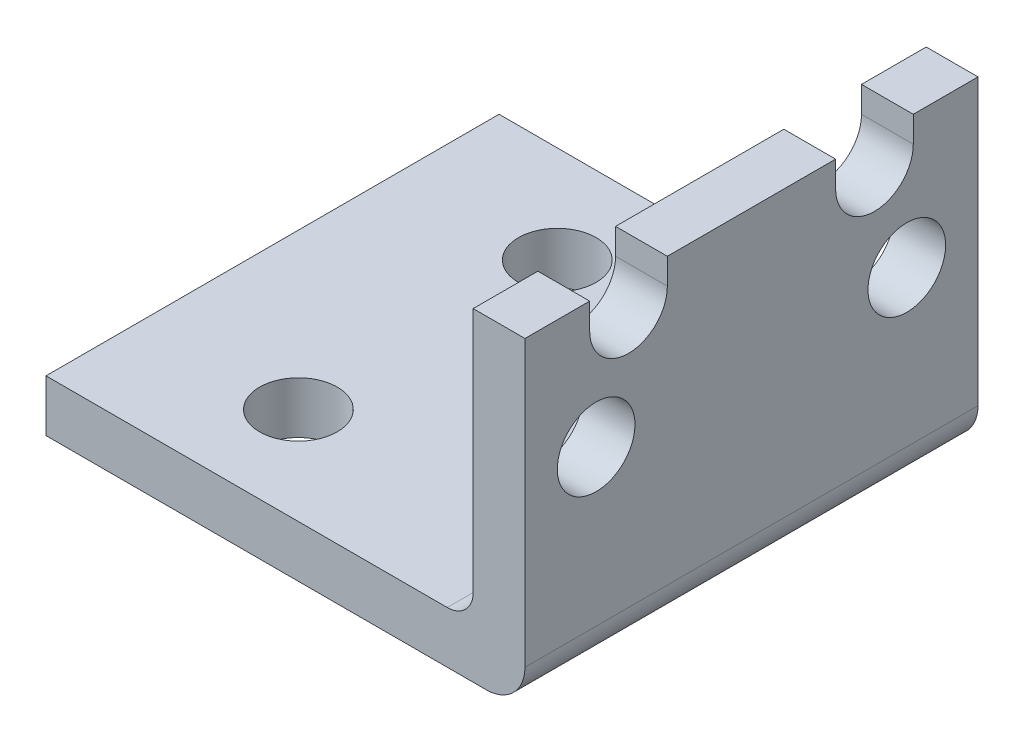
from build123d import *

# Parameters (mm, degrees)
EXTRUDE_1_DEPTH     = 35
SKETCH_2_R          = 3
CUT_EXTRUDE_2_DEPTH = 35
SKETCH_3_R          = 3
EXTRUDE_4_DEPTH     = 37
SKETCH_3_2_R        = 3
CUT_EXTRUDE_5_DEPTH = 57.771215716


with BuildPart() as part:
    # 草图1 → 拉伸1 (new body)
    with BuildSketch(Plane.XY):
        with BuildLine():
            ThreePointArc((18.167628925, -21.079292929), (19.581842488, -20.493506492), (20.167628925, -19.079292929))
            Line((20.167628925, -19.079292929), (20.167628925, -0.079292929))
            Line((20.167628925, -0.079292929), (24.167628925, -0.079292929))
            Line((24.167628925, -0.079292929), (24.167628925, -22.079292929))
            ThreePointArc((24.167628925, -22.079292929), (23.288949269, -24.200613273), (21.167628925, -25.079292929))
            Line((21.167628925, -25.079292929), (-12.832371075, -25.079292929))
            Line((-12.832371075, -25.079292929), (-12.832371075, -21.079292929))
            Line((-12.832371075, -21.079292929), (18.167628925, -21.079292929))
        make_face()
    extrude(amount=EXTRUDE_1_DEPTH)

    # 草图2 → 拉伸2 (cut)
    with BuildSketch(Plane.XZ.offset(25.079292929)):
        with Locations((-0.832371075, 7.5)):
            Circle(SKETCH_2_R)
        with Locations((-0.832371075, 27.5)):
            Circle(SKETCH_2_R)
    extrude(amount=-CUT_EXTRUDE_2_DEPTH, mode=Mode.SUBTRACT)

    # 草图3 → 拉伸4 (add, through all)
    with BuildSketch(Plane(origin=(24.167628925, 0, 0), x_dir=(0, 0, -1), z_dir=(1, 0, 0))):
        with Locations(Location((-5.5, -10.079292929, 0), (0, 0, 90))):
            Circle(SKETCH_3_R)
        with Locations(Location((-29.5, -10.079292929, 0), (0, 0, 90))):
            Circle(SKETCH_3_R)
        with BuildLine():
            Line((-5, -2.079292929), (-5, 0.455458984))
            Line((-5, 0.455458984), (-11, 0.455458984))
            Line((-11, 0.455458984), (-11, -2.079292929))
            ThreePointArc((-11, -2.079292929), (-8, -5.079292929), (-5, -2.079292929))
        make_face()
        with BuildLine():
            Line((-24, -2.079292929), (-24, 0.455458984))
            Line((-24, 0.455458984), (-30, 0.455458984))
            Line((-30, 0.455458984), (-30, -2.079292929))
            ThreePointArc((-30, -2.079292929), (-27, -5.079292929), (-24, -2.079292929))
        make_face()
    extrude(amount=-EXTRUDE_4_DEPTH)

    # 草图3<2> → 拉伸5 (cut, through all)
    with BuildSketch(Plane(origin=(24.167628925, 0, 0), x_dir=(0, 0, -1), z_dir=(1, 0, 0))):
        with Locations(Location((-5.5, -10.079292929, 0), (0, 0, 90))):
            Circle(SKETCH_3_2_R)
        with Locations(Location((-29.5, -10.079292929, 0), (0, 0, 90))):
            Circle(SKETCH_3_2_R)
        with BuildLine():
            Line((-5, -2.079292929), (-5, 0.455458984))
            Line((-5, 0.455458984), (-11, 0.455458984))
            Line((-11, 0.455458984), (-11, -2.079292929))
            ThreePointArc((-11, -2.079292929), (-8, -5.079292929), (-5, -2.079292929))
        make_face()
        with BuildLine():
            Line((-24, -2.079292929), (-24, 0.455458984))
            Line((-24, 0.455458984), (-30, 0.455458984))
            Line((-30, 0.455458984), (-30, -2.079292929))
            ThreePointArc((-30, -2.079292929), (-27, -5.079292929), (-24, -2.079292929))
        make_face()
    extrude(amount=-CUT_EXTRUDE_5_DEPTH, mode=Mode.SUBTRACT)


solid = part.part
